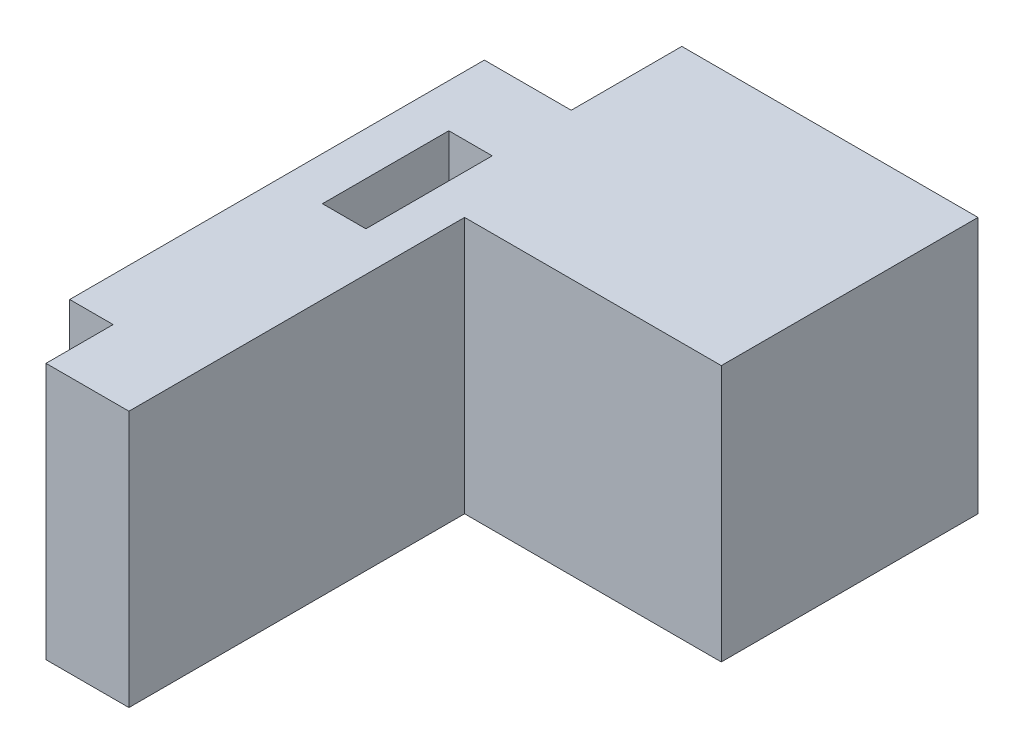
from build123d import *

# Parameters (mm, degrees)
SKIZZE1_W                       = 75
SKIZZE1_H                       = 65
SKIZZE1_W_2                     = 11
SKIZZE1_H_2                     = 20
AUFSATZ_LINEAR_AUSTRAGEN1_DEPTH = 65


with BuildPart() as part:
    # Skizze1 → Aufsatz-Linear austragen1 (new body)
    with BuildSketch(Plane(origin=(0, 0, 0), x_dir=(1, 0, 0), z_dir=(0, 1, 0))):
        Rectangle(SKIZZE1_W, SKIZZE1_H)
        with Locations((-43, -5.5)):
            Rectangle(SKIZZE1_W_2, SKIZZE1_H_2)
        Polygon((-48.5, -47.5), (-48.5, -15.5), (-48.5, 4.5), (-59.5, 4.5), (-59.5, -100.5), (-48.5, -100.5), align=None)
        Polygon((-37.5, -66.284082461), (-37.5, -47.5), (-48.5, -47.5), (-48.5, -100.5), (-48.5, -117.5), (-37.5, -117.5), align=None)
        Polygon((-27.5, -32.5), (-37.5, -32.5), (-37.5, -47.5), (-37.5, -66.284082461), (-37.5, -117.5), (-27.5, -117.5), align=None)
    extrude(amount=AUFSATZ_LINEAR_AUSTRAGEN1_DEPTH)


solid = part.part
